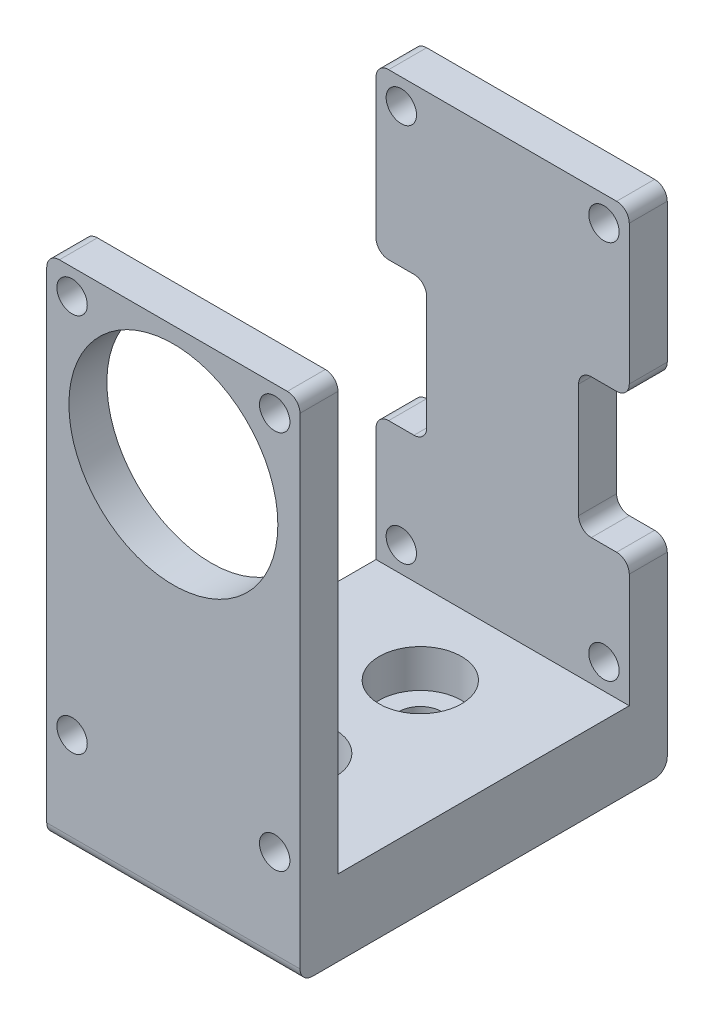
from build123d import *

# Parameters (mm, degrees)
BOSS_EXTRUDE1_DEPTH            = 10
CUT_EXTRUDE1_REACH             = 52.408
SKETCH2_R                      = 8.25
M2_CLEARANCE_HOLE1_D           = 2.4
CBORE_FOR_M3_SHCS1_D           = 3.4
CBORE_FOR_M3_SHCS1_CBORE_D     = 6.5
CBORE_FOR_M3_SHCS1_CBORE_DEPTH = 3
CUT_EXTRUDE2_REACH             = 52.408
SKETCH7_W                      = 4
SKETCH7_H                      = 11
FILLET1_R                      = 1


with BuildPart() as part:
    # Sketch1 → Boss-Extrude1 (new, symmetric)
    with BuildSketch(Plane(origin=(0, 0, 0), x_dir=(0, 0, -1), z_dir=(1, 0, 0))):
        Polygon((29, 40), (26, 40), (26, 6), (3, 6), (3, 40), (0, 40), (0, 0), (29, 0), align=None)
    extrude(amount=BOSS_EXTRUDE1_DEPTH, both=True)

    # Sketch2 → Cut-Extrude1 (cut, up to next)
    with BuildSketch(Plane.XY, mode=Mode.PRIVATE) as cut_extrude1_sk1:
        with Locations((0, 30.5)):
            Circle(SKETCH2_R)
    cut_extrude1_tool1 = extrude(cut_extrude1_sk1.sketch, amount=-CUT_EXTRUDE1_REACH, mode=Mode.PRIVATE) & part.part
    add(cut_extrude1_tool1.solids().sort_by_distance((0, 30.5, 0))[0], mode=Mode.SUBTRACT)

    # M2 Clearance Hole1 (through all)
    with Locations(Plane.XY):
        with Locations((-8, 8), (8, 8), (8, 38), (-8, 38)):
            Hole(M2_CLEARANCE_HOLE1_D / 2)

    # CBORE for M3 SHCS1 (through all)
    with Locations(Plane(origin=(0, 6, 0), x_dir=(1, 0, 0), z_dir=(0, 1, 0))):
        with Locations((0, 19.5), (0, 9.5)):
            CounterBoreHole(CBORE_FOR_M3_SHCS1_D / 2, CBORE_FOR_M3_SHCS1_CBORE_D / 2, CBORE_FOR_M3_SHCS1_CBORE_DEPTH)

    # Sketch7 → Cut-Extrude2 (cut, up to next)
    with BuildSketch(Plane.XY.offset(-29), mode=Mode.PRIVATE) as cut_extrude2_sk1:
        with Locations((8, 21.5)):
            Rectangle(SKETCH7_W, SKETCH7_H)
    cut_extrude2_tool1 = extrude(cut_extrude2_sk1.sketch, amount=CUT_EXTRUDE2_REACH, mode=Mode.PRIVATE) & part.part
    # Sketch7 → Cut-Extrude2 (cut, up to next)
    with BuildSketch(Plane.XY.offset(-29), mode=Mode.PRIVATE) as cut_extrude2_sk2:
        with Locations((-8, 21.5)):
            Rectangle(SKETCH7_W, SKETCH7_H)
    cut_extrude2_tool2 = extrude(cut_extrude2_sk2.sketch, amount=CUT_EXTRUDE2_REACH, mode=Mode.PRIVATE) & part.part
    add(cut_extrude2_tool1.solids().sort_by_distance((8, 21.5, -29))[0], mode=Mode.SUBTRACT)
    add(cut_extrude2_tool2.solids().sort_by_distance((-8, 21.5, -29))[0], mode=Mode.SUBTRACT)

    # Fillet1
    fillet1_edges = [part.edges().sort_by_distance(p)[0] for p in [
        (-6, 27, -27.5),
        (-10, 27, -27.5),
        (-10, 16, -27.5),
        (-6, 16, -27.5),
        (-10, 40, -1.5),
        (-10, 40, -27.5),
        (0, 0, -29),
        (0, 0, 0),
        (10, 40, -1.5),
        (10, 40, -27.5),
        (10, 16, -27.5),
        (10, 27, -27.5),
        (6, 27, -27.5),
        (6, 16, -27.5),
    ]]
    fillet(fillet1_edges, radius=FILLET1_R)


solid = part.part
